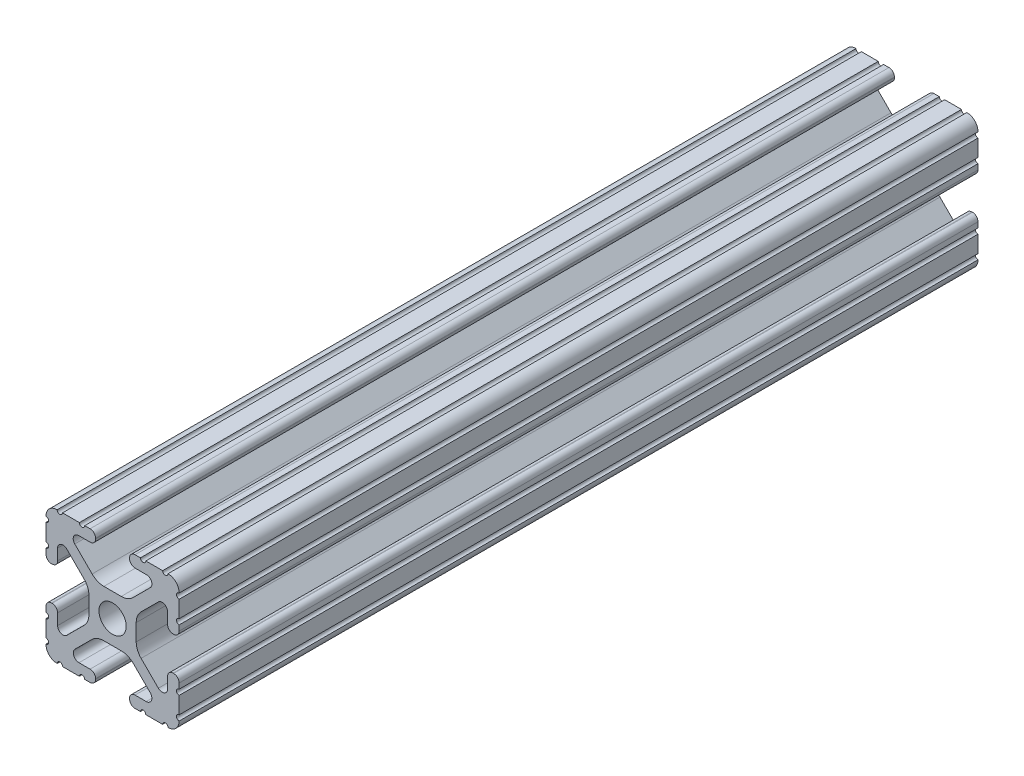
from build123d import *

# Parameters (mm, degrees)
SKETCH1_R           = 2.6035
BOSS_EXTRUDE1_DEPTH = 76.2


with BuildPart() as part:
    # Sketch1 → Boss-Extrude1 (new, symmetric)
    with BuildSketch(Plane.XY):
        with BuildLine():
            Line((-7.179650497, -8.645192506), (-3.952270251, -5.423690499))
            ThreePointArc((-3.952270251, -5.423690499), (-2.922936451, -4.736929036), (-1.709253557, -4.4958))
            Line((-1.709253557, -4.4958), (1.709253557, -4.4958))
            ThreePointArc((1.709253557, -4.4958), (2.922936451, -4.736929036), (3.952270251, -5.423690499))
            Line((3.952270251, -5.423690499), (7.179650497, -8.645192506))
            ThreePointArc((7.179650497, -8.645192506), (7.41473083, -9.822813117), (6.416408329, -10.4902))
            Line((6.416408329, -10.4902), (4.287512407, -10.4902))
            ThreePointArc((4.287512407, -10.4902), (3.54574862, -10.79744862), (3.2385, -11.539212407))
            Line((3.2385, -11.539212407), (3.2385, -11.650987593))
            ThreePointArc((3.2385, -11.650987593), (3.54574862, -12.39275138), (4.287512407, -12.7))
            Line((4.287512407, -12.7), (5.317126718, -12.7))
            ThreePointArc((5.317126718, -12.7), (5.825126718, -12.192), (6.333126718, -12.7))
            Line((6.333126718, -12.7), (9.550443118, -12.7))
            ThreePointArc((9.550443118, -12.7), (10.058366869, -12.192000006), (10.566443095, -12.699847501))
            ThreePointArc((10.566443095, -12.699847501), (12.082537762, -12.08250727), (12.699846982, -10.566399977))
            ThreePointArc((12.699846982, -10.566399977), (12.192000006, -10.058323491), (12.7, -9.5504))
            Line((12.7, -9.5504), (12.7, -6.3330836))
            ThreePointArc((12.7, -6.3330836), (12.192, -5.8250836), (12.7, -5.3170836))
            Line((12.7, -5.3170836), (12.7, -4.287469289))
            ThreePointArc((12.7, -4.287469289), (12.39275138, -3.545705502), (11.650987593, -3.238456882))
            Line((11.650987593, -3.238456882), (11.539212407, -3.238456882))
            ThreePointArc((11.539212407, -3.238456882), (10.79744862, -3.545705502), (10.4902, -4.287469289))
            Line((10.4902, -4.287469289), (10.4902, -6.402089023))
            ThreePointArc((10.4902, -6.402089023), (9.856505071, -7.351067942), (8.737131347, -7.129408934))
            Line((8.737131347, -7.129408934), (5.441005833, -3.840816462))
            ThreePointArc((5.441005833, -3.840816462), (4.750877967, -2.809883091), (4.5085, -1.593185507))
            Line((4.5085, -1.593185507), (4.5085, 1.593185507))
            ThreePointArc((4.5085, 1.593185507), (4.750877967, 2.809883091), (5.441005833, 3.840816462))
            Line((5.441005833, 3.840816462), (8.737131347, 7.129408934))
            ThreePointArc((8.737131347, 7.129408934), (9.856505071, 7.351067942), (10.4902, 6.402089023))
            Line((10.4902, 6.402089023), (10.4902, 4.287469289))
            ThreePointArc((10.4902, 4.287469289), (10.79744862, 3.545705502), (11.539212407, 3.238456882))
            Line((11.539212407, 3.238456882), (11.650987593, 3.238456882))
            ThreePointArc((11.650987593, 3.238456882), (12.39275138, 3.545705502), (12.7, 4.287469289))
            Line((12.7, 4.287469289), (12.7, 5.3170836))
            ThreePointArc((12.7, 5.3170836), (12.192, 5.8250836), (12.7, 6.3330836))
            Line((12.7, 6.3330836), (12.7, 9.5504))
            ThreePointArc((12.7, 9.5504), (12.192000006, 10.058323491), (12.699846982, 10.566399977))
            ThreePointArc((12.699846982, 10.566399977), (12.082537762, 12.08250727), (10.566443095, 12.699847501))
            ThreePointArc((10.566443095, 12.699847501), (10.058366869, 12.192000006), (9.550443118, 12.7))
            Line((9.550443118, 12.7), (6.333126718, 12.7))
            ThreePointArc((6.333126718, 12.7), (5.825126718, 12.192), (5.317126718, 12.7))
            Line((5.317126718, 12.7), (4.287512407, 12.7))
            ThreePointArc((4.287512407, 12.7), (3.54574862, 12.39275138), (3.2385, 11.650987593))
            Line((3.2385, 11.650987593), (3.2385, 11.539212407))
            ThreePointArc((3.2385, 11.539212407), (3.54574862, 10.79744862), (4.287512407, 10.4902))
            Line((4.287512407, 10.4902), (6.476788598, 10.4902))
            ThreePointArc((6.476788598, 10.4902), (7.432222385, 9.85140422), (7.207036008, 8.724370562))
            Line((7.207036008, 8.724370562), (3.898272566, 5.423169045))
            ThreePointArc((3.898272566, 5.423169045), (2.869120213, 4.736787962), (1.655778399, 4.4958))
            Line((1.655778399, 4.4958), (-1.655778399, 4.4958))
            ThreePointArc((-1.655778399, 4.4958), (-2.869120213, 4.736787962), (-3.898272566, 5.423169045))
            Line((-3.898272566, 5.423169045), (-7.207036008, 8.724370562))
            ThreePointArc((-7.207036008, 8.724370562), (-7.432222385, 9.85140422), (-6.476788598, 10.4902))
            Line((-6.476788598, 10.4902), (-4.287512407, 10.4902))
            ThreePointArc((-4.287512407, 10.4902), (-3.54574862, 10.79744862), (-3.2385, 11.539212407))
            Line((-3.2385, 11.539212407), (-3.2385, 11.650987593))
            ThreePointArc((-3.2385, 11.650987593), (-3.54574862, 12.39275138), (-4.287512407, 12.7))
            Line((-4.287512407, 12.7), (-5.317126718, 12.7))
            ThreePointArc((-5.317126718, 12.7), (-5.825126718, 12.192), (-6.333126718, 12.7))
            Line((-6.333126718, 12.7), (-9.550443118, 12.7))
            ThreePointArc((-9.550443118, 12.7), (-10.058366869, 12.192000006), (-10.566443095, 12.699847501))
            ThreePointArc((-10.566443095, 12.699847501), (-12.082537762, 12.08250727), (-12.699846982, 10.566399977))
            ThreePointArc((-12.699846982, 10.566399977), (-12.192000006, 10.058323491), (-12.7, 9.5504))
            Line((-12.7, 9.5504), (-12.7, 6.3330836))
            ThreePointArc((-12.7, 6.3330836), (-12.192, 5.8250836), (-12.7, 5.3170836))
            Line((-12.7, 5.3170836), (-12.7, 4.287469289))
            ThreePointArc((-12.7, 4.287469289), (-12.39275138, 3.545705502), (-11.650987593, 3.238456882))
            Line((-11.650987593, 3.238456882), (-11.539212407, 3.238456882))
            ThreePointArc((-11.539212407, 3.238456882), (-10.79744862, 3.545705502), (-10.4902, 4.287469289))
            Line((-10.4902, 4.287469289), (-10.4902, 6.402089023))
            ThreePointArc((-10.4902, 6.402089023), (-9.856505071, 7.351067942), (-8.737131347, 7.129408934))
            Line((-8.737131347, 7.129408934), (-5.441005833, 3.840816462))
            ThreePointArc((-5.441005833, 3.840816462), (-4.750877967, 2.809883091), (-4.5085, 1.593185507))
            Line((-4.5085, 1.593185507), (-4.5085, -1.593185507))
            ThreePointArc((-4.5085, -1.593185507), (-4.750877967, -2.809883091), (-5.441005833, -3.840816462))
            Line((-5.441005833, -3.840816462), (-8.737131347, -7.129408934))
            ThreePointArc((-8.737131347, -7.129408934), (-9.856505071, -7.351067942), (-10.4902, -6.402089023))
            Line((-10.4902, -6.402089023), (-10.4902, -4.287469289))
            ThreePointArc((-10.4902, -4.287469289), (-10.79744862, -3.545705502), (-11.539212407, -3.238456882))
            Line((-11.539212407, -3.238456882), (-11.650987593, -3.238456882))
            ThreePointArc((-11.650987593, -3.238456882), (-12.39275138, -3.545705502), (-12.7, -4.287469289))
            Line((-12.7, -4.287469289), (-12.7, -5.3170836))
            ThreePointArc((-12.7, -5.3170836), (-12.192, -5.8250836), (-12.7, -6.3330836))
            Line((-12.7, -6.3330836), (-12.7, -9.5504))
            ThreePointArc((-12.7, -9.5504), (-12.192000006, -10.058323491), (-12.699846982, -10.566399977))
            ThreePointArc((-12.699846982, -10.566399977), (-12.082537762, -12.08250727), (-10.566443095, -12.699847501))
            ThreePointArc((-10.566443095, -12.699847501), (-10.058366869, -12.192000006), (-9.550443118, -12.7))
            Line((-9.550443118, -12.7), (-6.333126718, -12.7))
            ThreePointArc((-6.333126718, -12.7), (-5.825126718, -12.192), (-5.317126718, -12.7))
            Line((-5.317126718, -12.7), (-4.287512407, -12.7))
            ThreePointArc((-4.287512407, -12.7), (-3.54574862, -12.39275138), (-3.2385, -11.650987593))
            Line((-3.2385, -11.650987593), (-3.2385, -11.539212407))
            ThreePointArc((-3.2385, -11.539212407), (-3.54574862, -10.79744862), (-4.287512407, -10.4902))
            Line((-4.287512407, -10.4902), (-6.416408329, -10.4902))
            ThreePointArc((-6.416408329, -10.4902), (-7.41473083, -9.822813117), (-7.179650497, -8.645192506))
        make_face()
        with Locations(Location((0, 0, 0), (0, 0, 180))):
            Circle(SKETCH1_R, mode=Mode.SUBTRACT)
    extrude(amount=BOSS_EXTRUDE1_DEPTH, both=True)


solid = part.part
